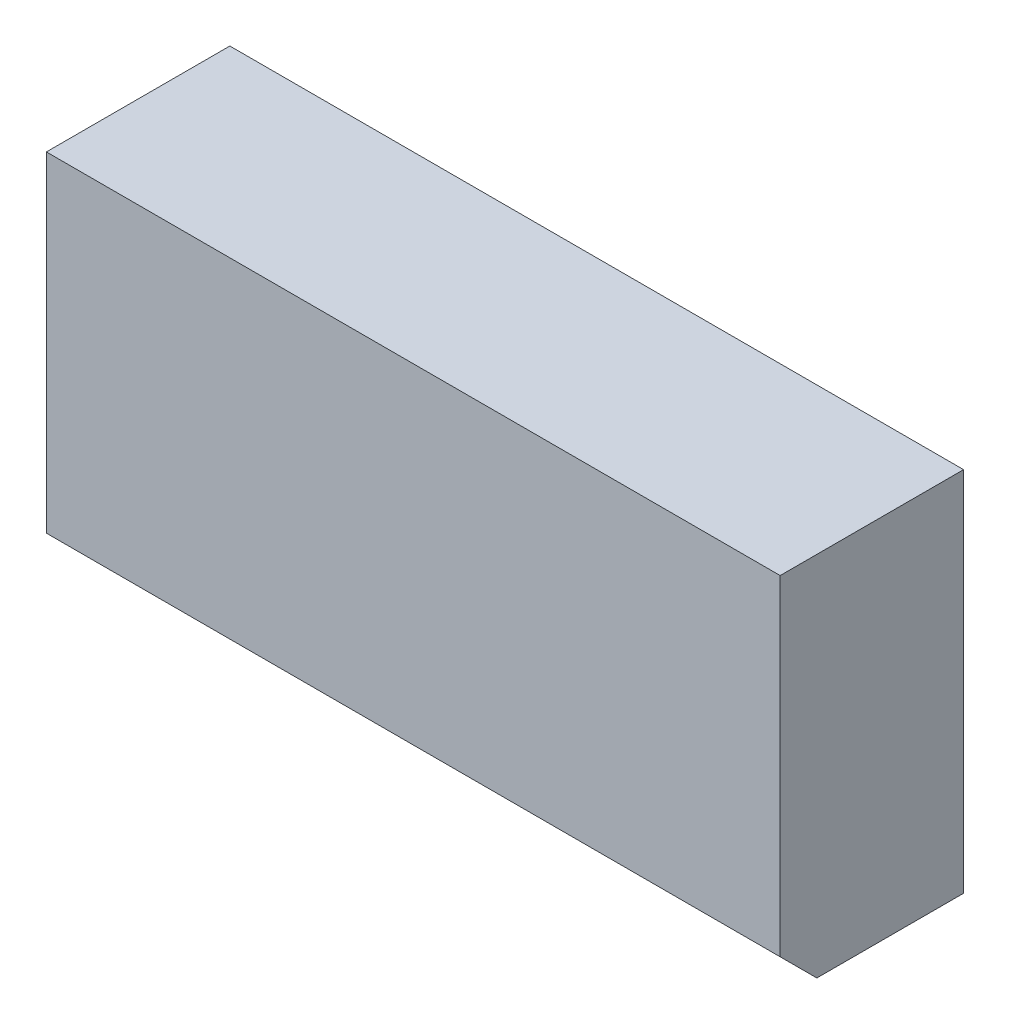
from build123d import *

# Parameters (mm, degrees)
SKETCH1_W           = 40
SKETCH1_H           = 20
BOSS_EXTRUDE1_DEPTH = 10
CHAMFER1_SIZE       = 2


with BuildPart() as part:
    # Sketch1 → Boss-Extrude1 (new body)
    with BuildSketch(Plane.XY):
        with Locations((20, 10)):
            Rectangle(SKETCH1_W, SKETCH1_H)
    extrude(amount=BOSS_EXTRUDE1_DEPTH)

    # Chamfer1
    chamfer1_edges = [part.edges().sort_by_distance(p)[0] for p in [
        (20, 0, 10),
    ]]
    chamfer(chamfer1_edges, length=CHAMFER1_SIZE)


solid = part.part
